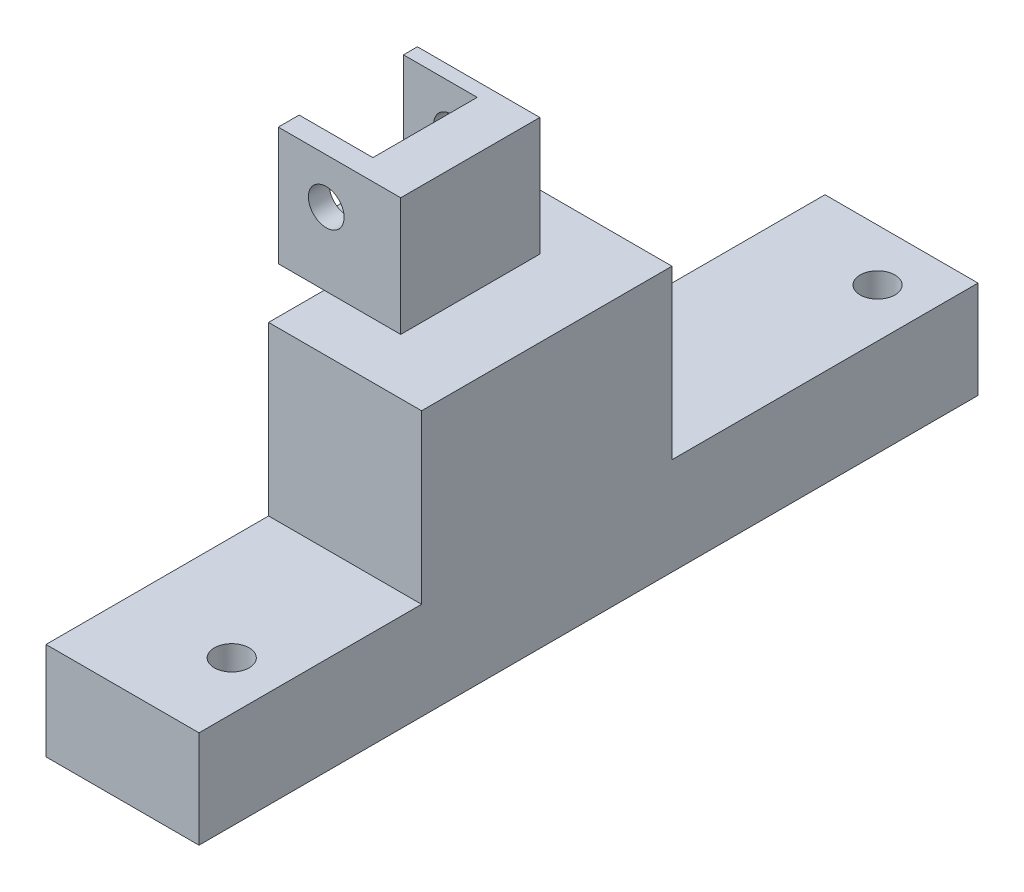
from build123d import *

# Parameters (mm, degrees)
BOSS_EXTRUDE1_DEPTH = 21.59
SKETCH2_W           = 22.352
SKETCH2_H           = 21.6154
SKETCH2_R           = 3.2639
BOSS_EXTRUDE2_DEPTH = 3.81
BOSS_EXTRUDE3_START = -2.54
SKETCH3_R           = 3.2639
BOSS_EXTRUDE3_DEPTH = 2.54
SKETCH6_W           = 27.94
SKETCH6_H           = 142.24
SKETCH6_R           = 3.175
BOSS_EXTRUDE4_DEPTH = 48.388036719
SKETCH7_W           = 40.64
SKETCH7_H           = 30.608036719
SKETCH7_W_2         = 55.88
CUT_EXTRUDE1_DEPTH  = 30.226


with BuildPart() as part:
    # Sketch1 → Boss-Extrude1 (new body)
    with BuildSketch(Plane.XY):
        with BuildLine():
            Line((801.338321143, 356.769436719), (792.583825879, 356.769436719))
            Line((792.583825879, 356.769436719), (792.583825879, 352.959436719))
            Line((792.583825879, 352.959436719), (814.935825879, 352.959436719))
            Line((814.935825879, 352.959436719), (814.935825879, 374.574836719))
            Line((814.935825879, 374.574836719), (806.045825879, 374.574836719))
            ThreePointArc((806.045825879, 374.574836719), (810.863321143, 366.294436719), (806.045825879, 358.014036719))
            ThreePointArc((806.045825879, 358.014036719), (803.772947911, 357.085841957), (801.338321143, 356.769436719))
        make_face()
    extrude(amount=-BOSS_EXTRUDE1_DEPTH)

    # Sketch2 → Boss-Extrude2 (add)
    with BuildSketch(Plane.XY):
        with Locations((803.759825879, 363.767136719)):
            Rectangle(SKETCH2_W, SKETCH2_H)
        with Locations((801.338321143, 366.294436719)):
            Circle(SKETCH2_R, mode=Mode.SUBTRACT)
    extrude(amount=BOSS_EXTRUDE2_DEPTH)

    # Sketch3 → Boss-Extrude3 (add)
    with BuildSketch(Plane(origin=(0, 0, -21.59), x_dir=(-1, 0, 0), z_dir=(0, 0, -1)).offset(BOSS_EXTRUDE3_START)):
        with BuildLine():
            Line((-792.583825879, 356.769436719), (-792.583825879, 374.574836719))
            Line((-792.583825879, 374.574836719), (-806.045825879, 374.574836719))
            ThreePointArc((-806.045825879, 374.574836719), (-810.546915906, 363.859809951), (-801.338321143, 356.769436719))
            Line((-801.338321143, 356.769436719), (-792.583825879, 356.769436719))
        make_face()
        with Locations(Location((-801.338321143, 366.294436719, 0), (0, 0, 180))):
            Circle(SKETCH3_R, mode=Mode.SUBTRACT)
    extrude(amount=BOSS_EXTRUDE3_DEPTH)

    # Sketch6 → Boss-Extrude4 (add)
    with BuildSketch(Plane.XZ.offset(-352.959436719)):
        with Locations((814.935825879, -16.51)):
            Rectangle(SKETCH6_W, SKETCH6_H)
        with Locations(Location((820.039, 39.768571429, 0), (0, 0, 90))):
            Circle(SKETCH6_R, mode=Mode.SUBTRACT)
        with Locations(Location((820.039, -78.16, 0), (0, 0, 90))):
            Circle(SKETCH6_R, mode=Mode.SUBTRACT)
    extrude(amount=BOSS_EXTRUDE4_DEPTH)

    # Sketch7 → Cut-Extrude1 (cut)
    with BuildSketch(Plane(origin=(828.905825879, 0, 0), x_dir=(0, 0, -1), z_dir=(1, 0, 0))):
        with Locations((-34.29, 337.65541836)):
            Rectangle(SKETCH7_W, SKETCH7_H)
        with Locations((59.69, 337.65541836)):
            Rectangle(SKETCH7_W_2, SKETCH7_H)
    extrude(amount=-CUT_EXTRUDE1_DEPTH, mode=Mode.SUBTRACT)


solid = part.part
